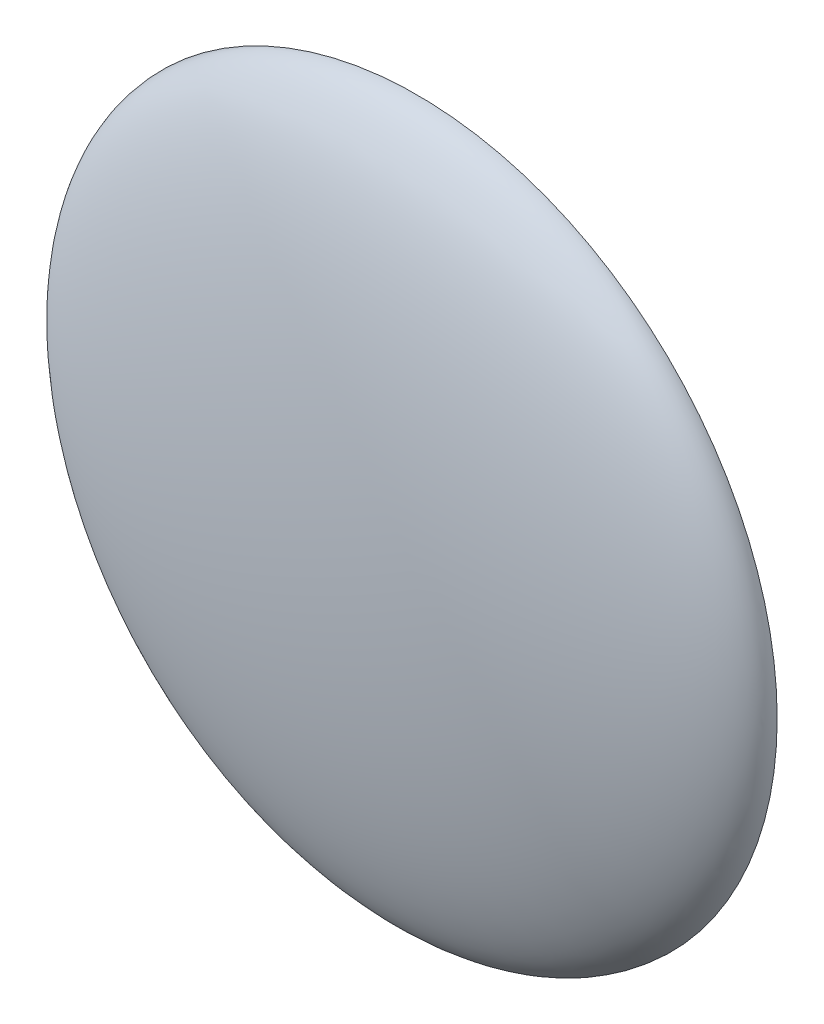
from build123d import *


with BuildPart() as part:
    # Sketch1 → Revolve1 (revolve)
    with BuildSketch(Plane(origin=(0, 0, 0), x_dir=(1, 0, 0), z_dir=(0, 1, 0))):
        with BuildLine():
            Line((0, 0), (0, 130))
            Line((0, 130), (-540, 130))
            add(Edge.make_bspline(
                [(-540, 130), (-540, 0), (0, 0)],
                knots=[0, 0, 0, 1.570796327, 1.570796327, 1.570796327], degree=2, weights=[1, 0.707106781, 1]))
        make_face()
    revolve(axis=Axis((0, 0, 0), (0, 0, -1)))


solid = part.part
